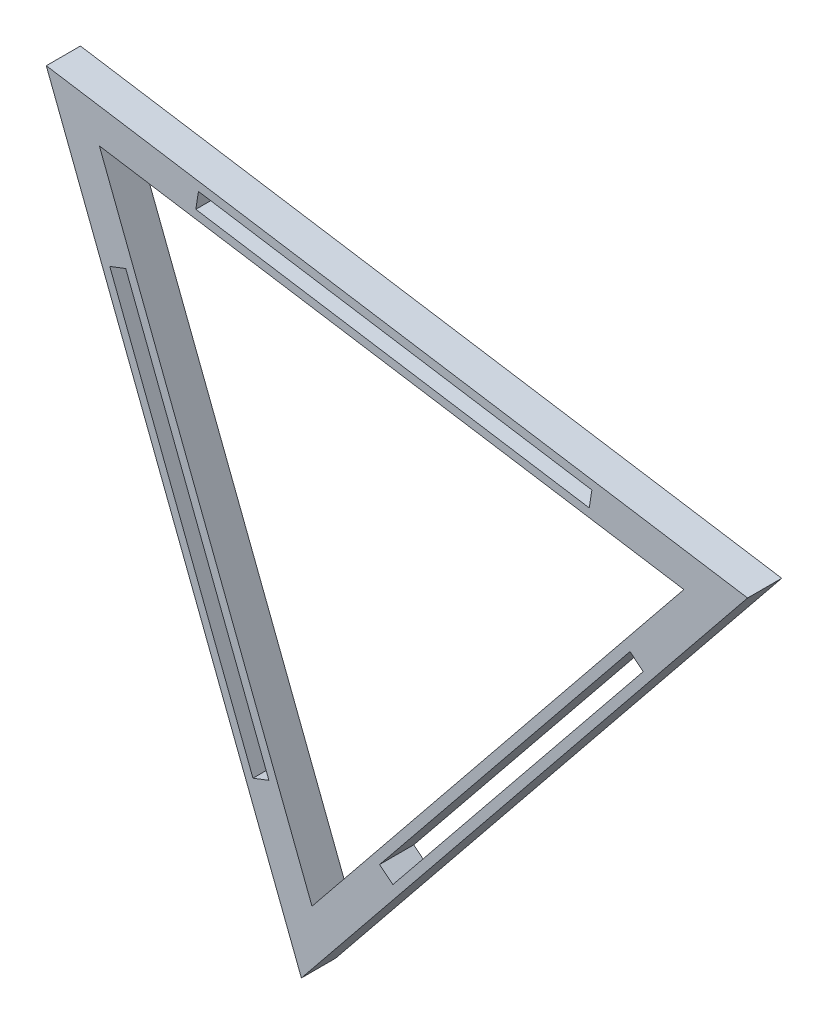
from build123d import *

# Parameters (mm, degrees)
BOSS_EXTRU_2_DEPTH      = 6
ENL_V_MAT_EXTRU_2_DEPTH = 10


with BuildPart() as part:
    # Esquisse1 → Boss.-Extru.2 (new body)
    with BuildSketch(Plane.XY):
        Polygon((-83.455959888, 54.712062767), (39.812904953, 35.321710103), (-38.614065462, -61.737082013), align=None)
        Polygon((28.614490816, 31.009457699), (-36.749378522, -49.882844686), (-74.12223269, 47.170077843), align=None, mode=Mode.SUBTRACT)
    extrude(amount=BOSS_EXTRU_2_DEPTH)

    # Esquisse2 → Enlèv. mat.-Extru.2 (cut)
    with BuildSketch(Plane.XY.offset(6)):
        Polygon((-24.872050824, -37.598295416), (19.142614995, 16.832478902), (21.475362465, 14.946136081), (-22.539303353, -39.484638237), align=None)
        Polygon((-57.172566376, 45.990983286), (11.977902, 35.118415816), (12.443869177, 38.082007318), (-56.706599198, 48.954574788), align=None)
        Polygon((-47.127893484, -35.578319674), (-72.28905902, 29.74331341), (-69.48956046, 30.821649076), (-44.328394923, -34.499984009), align=None)
    extrude(amount=-ENL_V_MAT_EXTRU_2_DEPTH, mode=Mode.SUBTRACT)


solid = part.part
